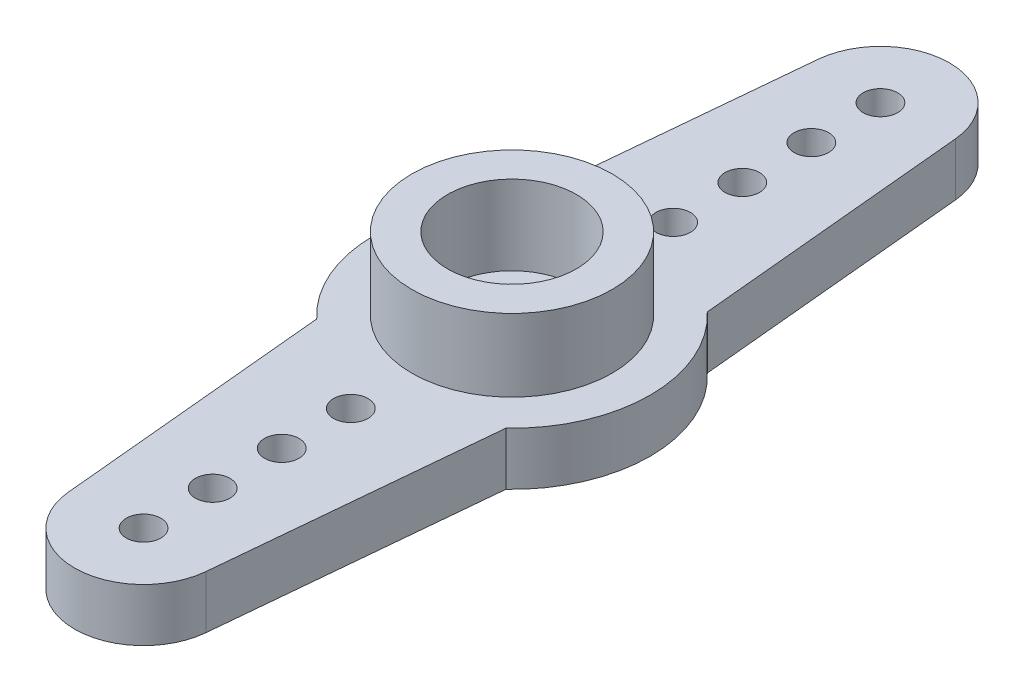
from build123d import *

# Parameters (mm, degrees)
SKETCH1_R               = 4.35
SKETCH1_R_2             = 2.8
BOSS_EXTRUDE1_DEPTH     = 5.45
SKETCH2_R               = 4.35
BOSS_EXTRUDE2_DEPTH     = 2.3
CUT_EXTRUDE2_REACH      = 22.657
SKETCH3_R               = 0.75
LPATTERN1_COUNT         = 4
LPATTERN1_PITCH         = 3
MIRROR1_COPY_1_REACH    = 22.657
MIRROR1_COPY_1_SKETCH_R = 0.75
MIRROR1_COPY_2_REACH    = 22.657
MIRROR1_COPY_2_SKETCH_R = 0.75
MIRROR1_COPY_3_REACH    = 22.657
MIRROR1_COPY_3_SKETCH_R = 0.75
SKETCH5_R               = 2.8
SKETCH5_R_2             = 1.5
BOSS_EXTRUDE3_DEPTH     = 2


with BuildPart() as part:
    # Sketch1 → Boss-Extrude1 (new body)
    with BuildSketch(Plane(origin=(0, 0, 0), x_dir=(1, 0, 0), z_dir=(0, 1, 0))):
        with Locations(Location((0, 0, 0), (0, 0, 270))):
            Circle(SKETCH1_R)
        with Locations(Location((0, 0, 0), (0, 0, 270))):
            Circle(SKETCH1_R_2, mode=Mode.SUBTRACT)
    extrude(amount=BOSS_EXTRUDE1_DEPTH)

    # Sketch2 → Boss-Extrude2 (add)
    with BuildSketch(Plane(origin=(0, 0, 0), x_dir=(1, 0, 0), z_dir=(0, 1, 0))):
        with BuildLine():
            ThreePointArc((2.98678731, 16.28125), (0, 19), (-2.98678731, 16.28125))
            Line((-2.98678731, 16.28125), (-4.108122187, 4.373023221))
            ThreePointArc((-4.108122187, 4.373023221), (-6, 0), (-4.108122187, -4.373023221))
            Line((-4.108122187, -4.373023221), (-2.98678731, -16.28125))
            ThreePointArc((-2.98678731, -16.28125), (0, -19), (2.98678731, -16.28125))
            Line((2.98678731, -16.28125), (4.108122187, -4.373023221))
            ThreePointArc((4.108122187, -4.373023221), (6, 0), (4.108122187, 4.373023221))
            Line((4.108122187, 4.373023221), (2.98678731, 16.28125))
        make_face()
        with Locations(Location((0, 0, 0), (0, 0, 270))):
            Circle(SKETCH2_R, mode=Mode.SUBTRACT)
    extrude(amount=BOSS_EXTRUDE2_DEPTH)

    # Sketch3 → Cut-Extrude2 (cut, up to next)
    with BuildSketch(Plane(origin=(0, 0, 0), x_dir=(1, 0, 0), z_dir=(0, 1, 0)), mode=Mode.PRIVATE) as cut_extrude2_sk1:
        with Locations(Location((0, 7, 0), (0, 0, 270))):
            Circle(SKETCH3_R)
    cut_extrude2_tool1 = extrude(cut_extrude2_sk1.sketch, amount=CUT_EXTRUDE2_REACH, mode=Mode.PRIVATE) & part.part
    cut_extrude2 = cut_extrude2_tool1.solids().sort_by_distance((0, 0, -7))[0]
    add(cut_extrude2, mode=Mode.SUBTRACT)

    # LPattern1: Cut-Extrude2 ×4
    with Locations(*[(0, 0, -i * LPATTERN1_PITCH) for i in range(1, LPATTERN1_COUNT)]):
        add(cut_extrude2, mode=Mode.SUBTRACT)

    # Mirror1: Cut-Extrude2 across plane
    add(cut_extrude2.mirror(Plane.XY), mode=Mode.SUBTRACT)

    # Mirror1 copy 1 sketch → Mirror1 copy 1 (cut, up to next)
    with BuildSketch(Plane(origin=(0, 0, 3), x_dir=(1, 0, 0), z_dir=(0, 1, 0)), mode=Mode.PRIVATE) as mirror1_copy_1_sk1:
        with Locations((0, -7)):
            Circle(MIRROR1_COPY_1_SKETCH_R)
    mirror1_copy_1_tool1 = extrude(mirror1_copy_1_sk1.sketch, amount=MIRROR1_COPY_1_REACH, mode=Mode.PRIVATE) & part.part
    add(mirror1_copy_1_tool1.solids().sort_by_distance((0, 0, 10))[0], mode=Mode.SUBTRACT)

    # Mirror1 copy 2 sketch → Mirror1 copy 2 (cut, up to next)
    with BuildSketch(Plane(origin=(0, 0, 6), x_dir=(1, 0, 0), z_dir=(0, 1, 0)), mode=Mode.PRIVATE) as mirror1_copy_2_sk1:
        with Locations((0, -7)):
            Circle(MIRROR1_COPY_2_SKETCH_R)
    mirror1_copy_2_tool1 = extrude(mirror1_copy_2_sk1.sketch, amount=MIRROR1_COPY_2_REACH, mode=Mode.PRIVATE) & part.part
    add(mirror1_copy_2_tool1.solids().sort_by_distance((0, 0, 13))[0], mode=Mode.SUBTRACT)

    # Mirror1 copy 3 sketch → Mirror1 copy 3 (cut, up to next)
    with BuildSketch(Plane(origin=(0, 0, 9), x_dir=(1, 0, 0), z_dir=(0, 1, 0)), mode=Mode.PRIVATE) as mirror1_copy_3_sk1:
        with Locations((0, -7)):
            Circle(MIRROR1_COPY_3_SKETCH_R)
    mirror1_copy_3_tool1 = extrude(mirror1_copy_3_sk1.sketch, amount=MIRROR1_COPY_3_REACH, mode=Mode.PRIVATE) & part.part
    add(mirror1_copy_3_tool1.solids().sort_by_distance((0, 0, 16))[0], mode=Mode.SUBTRACT)

    # Sketch5 → Boss-Extrude3 (add)
    with BuildSketch(Plane(origin=(0, 0, 0), x_dir=(1, 0, 0), z_dir=(0, 1, 0))):
        with Locations(Location((0, 0, 0), (0, 0, 270))):
            Circle(SKETCH5_R)
        with Locations(Location((0, 0, 0), (0, 0, 270))):
            Circle(SKETCH5_R_2, mode=Mode.SUBTRACT)
    extrude(amount=BOSS_EXTRUDE3_DEPTH)


solid = part.part
